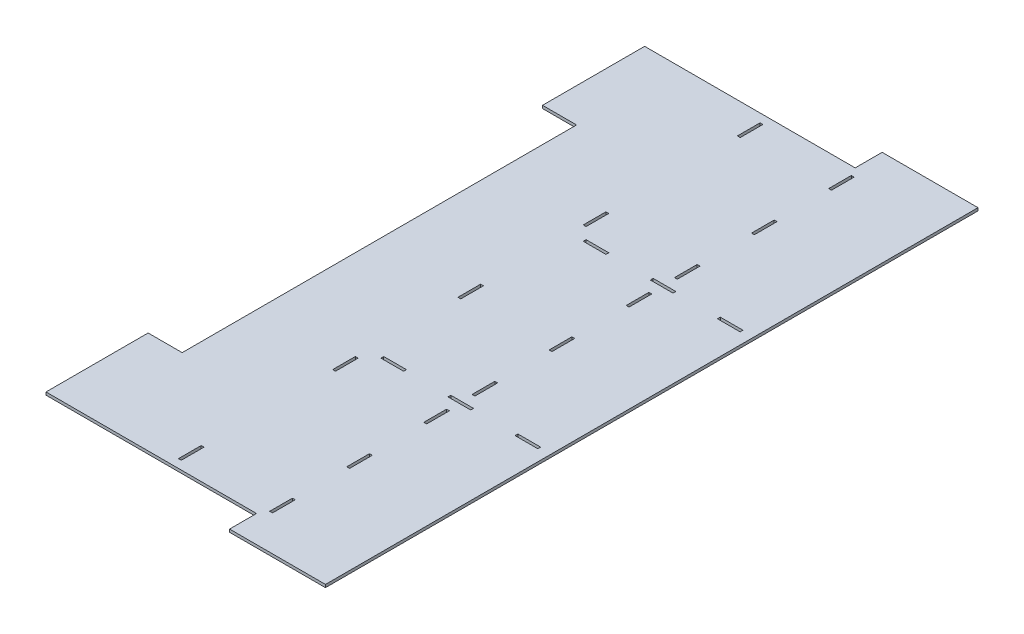
from build123d import *

# Parameters (mm, degrees)
SKETCH3_W           = 304.8
SKETCH3_H           = 669.93516
SKETCH3_W_2         = 25.4
SKETCH3_H_2         = 3.175
SKETCH3_W_3         = 3.175
SKETCH3_H_3         = 25.4
BOSS_EXTRUDE1_DEPTH = 3.175
SKETCH6_W           = 107.287119944
SKETCH6_H           = 30.1625
SKETCH6_W_2         = 38.1
SKETCH6_H_2         = 114.3
BOSS_EXTRUDE2_DEPTH = 3.175


with BuildPart() as part:
    # Sketch3 → Boss-Extrude1 (new body)
    with BuildSketch(Plane(origin=(0, 0, 0), x_dir=(1, 0, 0), z_dir=(0, 1, 0))):
        with Locations((48.58004, 334.96758)):
            Rectangle(SKETCH3_W, SKETCH3_H)
        with Locations((25.4, 448.21094)):
            Rectangle(SKETCH3_W_2, SKETCH3_H_2, mode=Mode.SUBTRACT)
        with Locations((175.58004, 448.21094)):
            Rectangle(SKETCH3_W_2, SKETCH3_H_2, mode=Mode.SUBTRACT)
        with Locations((100.49002, 448.21094)):
            Rectangle(SKETCH3_W_2, SKETCH3_H_2, mode=Mode.SUBTRACT)
        with Locations((100.49002, 647.71016)):
            Rectangle(SKETCH3_W_3, SKETCH3_H_3, mode=Mode.SUBTRACT)
        with Locations((100.49002, 475.19844)):
            Rectangle(SKETCH3_W_3, SKETCH3_H_3, mode=Mode.SUBTRACT)
        with Locations((100.49002, 561.4543)):
            Rectangle(SKETCH3_W_3, SKETCH3_H_3, mode=Mode.SUBTRACT)
        with Locations((100.49002, 421.22344)):
            Rectangle(SKETCH3_W_3, SKETCH3_H_3, mode=Mode.SUBTRACT)
        with Locations((100.49002, 334.96758)):
            Rectangle(SKETCH3_W_3, SKETCH3_H_3, mode=Mode.SUBTRACT)
        with Locations((100.49002, 248.71172)):
            Rectangle(SKETCH3_W_3, SKETCH3_H_3, mode=Mode.SUBTRACT)
        with Locations((25.4, 221.72422)):
            Rectangle(SKETCH3_W_2, SKETCH3_H_2, mode=Mode.SUBTRACT)
        with Locations((100.49002, 221.72422)):
            Rectangle(SKETCH3_W_2, SKETCH3_H_2, mode=Mode.SUBTRACT)
        with Locations((175.58004, 221.72422)):
            Rectangle(SKETCH3_W_2, SKETCH3_H_2, mode=Mode.SUBTRACT)
        with Locations((100.49002, 22.225)):
            Rectangle(SKETCH3_W_3, SKETCH3_H_3, mode=Mode.SUBTRACT)
        with Locations((100.49002, 108.48086)):
            Rectangle(SKETCH3_W_3, SKETCH3_H_3, mode=Mode.SUBTRACT)
        with Locations((100.49002, 194.73672)):
            Rectangle(SKETCH3_W_3, SKETCH3_H_3, mode=Mode.SUBTRACT)
        with Locations((-1.59258, 647.71016)):
            Rectangle(SKETCH3_W_3, SKETCH3_H_3, mode=Mode.SUBTRACT)
        with Locations((-1.59258, 475.19844)):
            Rectangle(SKETCH3_W_3, SKETCH3_H_3, mode=Mode.SUBTRACT)
        with Locations((-1.59258, 334.96758)):
            Rectangle(SKETCH3_W_3, SKETCH3_H_3, mode=Mode.SUBTRACT)
        with Locations((-1.59258, 194.73672)):
            Rectangle(SKETCH3_W_3, SKETCH3_H_3, mode=Mode.SUBTRACT)
        with Locations((-1.59258, 22.225)):
            Rectangle(SKETCH3_W_3, SKETCH3_H_3, mode=Mode.SUBTRACT)
    extrude(amount=BOSS_EXTRUDE1_DEPTH)

    # Sketch6 → Boss-Extrude2 (add)
    with BuildSketch(Plane(origin=(0, 3.175, 0), x_dir=(1, 0, 0), z_dir=(0, 1, 0))):
        with Locations((147.336480028, 685.01641)):
            Rectangle(SKETCH6_W, SKETCH6_H)
        with Locations((147.336480028, -15.08125)):
            Rectangle(SKETCH6_W, SKETCH6_H)
        with Locations((-122.86996, 612.78516)):
            Rectangle(SKETCH6_W_2, SKETCH6_H_2)
        with Locations((-122.86996, 57.15)):
            Rectangle(SKETCH6_W_2, SKETCH6_H_2)
    extrude(amount=-BOSS_EXTRUDE2_DEPTH)


solid = part.part
